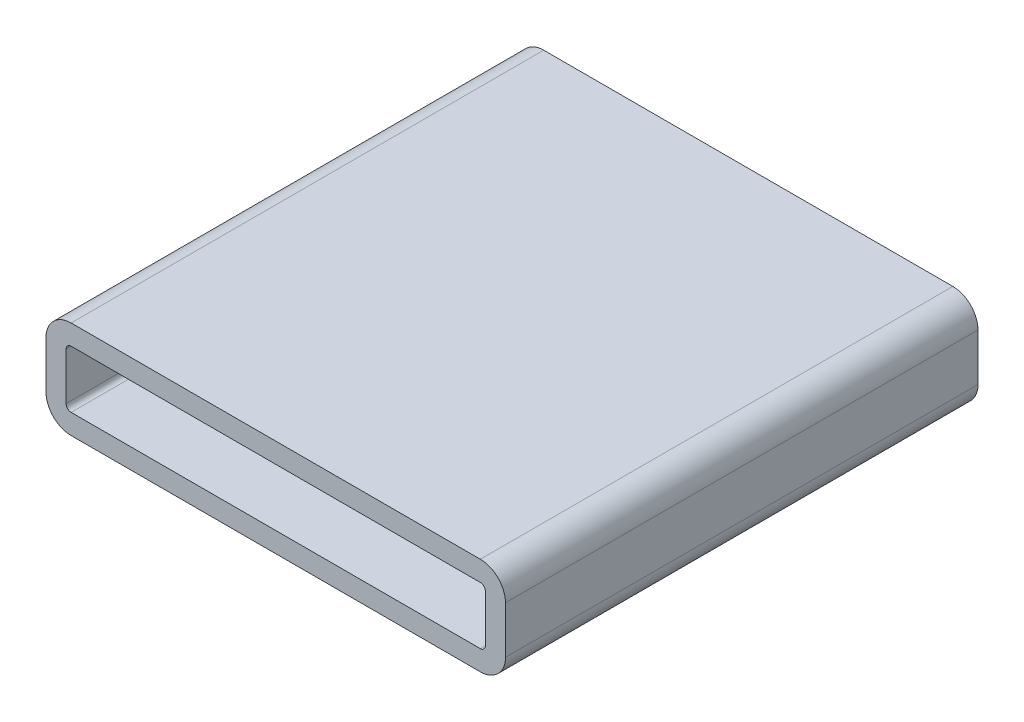
from build123d import *

# Parameters (mm, degrees)
BOSS_EXTRUDE1_DEPTH = 47


with BuildPart() as part:
    # Sketch1 → Boss-Extrude1 (new body)
    with BuildSketch(Plane.XY):
        with BuildLine():
            Line((-20.35, 4.85), (20.35, 4.85))
            ThreePointArc((20.35, 4.85), (22.117766953, 4.117766953), (22.85, 2.35))
            Line((22.85, 2.35), (22.85, -2.35))
            ThreePointArc((22.85, -2.35), (22.117766953, -4.117766953), (20.35, -4.85))
            Line((20.35, -4.85), (-20.35, -4.85))
            ThreePointArc((-20.35, -4.85), (-22.117766953, -4.117766953), (-22.85, -2.35))
            Line((-22.85, -2.35), (-22.85, 2.35))
            ThreePointArc((-22.85, 2.35), (-22.117766953, 4.117766953), (-20.35, 4.85))
        make_face()
        with BuildLine():
            Line((-20.35, -2.85), (20.35, -2.85))
            ThreePointArc((20.35, -2.85), (20.703553391, -2.703553391), (20.85, -2.35))
            Line((20.85, -2.35), (20.85, 2.35))
            ThreePointArc((20.85, 2.35), (20.703553391, 2.703553391), (20.35, 2.85))
            Line((20.35, 2.85), (-20.35, 2.85))
            ThreePointArc((-20.35, 2.85), (-20.703553391, 2.703553391), (-20.85, 2.35))
            Line((-20.85, 2.35), (-20.85, -2.35))
            ThreePointArc((-20.85, -2.35), (-20.703553391, -2.703553391), (-20.35, -2.85))
        make_face(mode=Mode.SUBTRACT)
    extrude(amount=BOSS_EXTRUDE1_DEPTH)


solid = part.part
